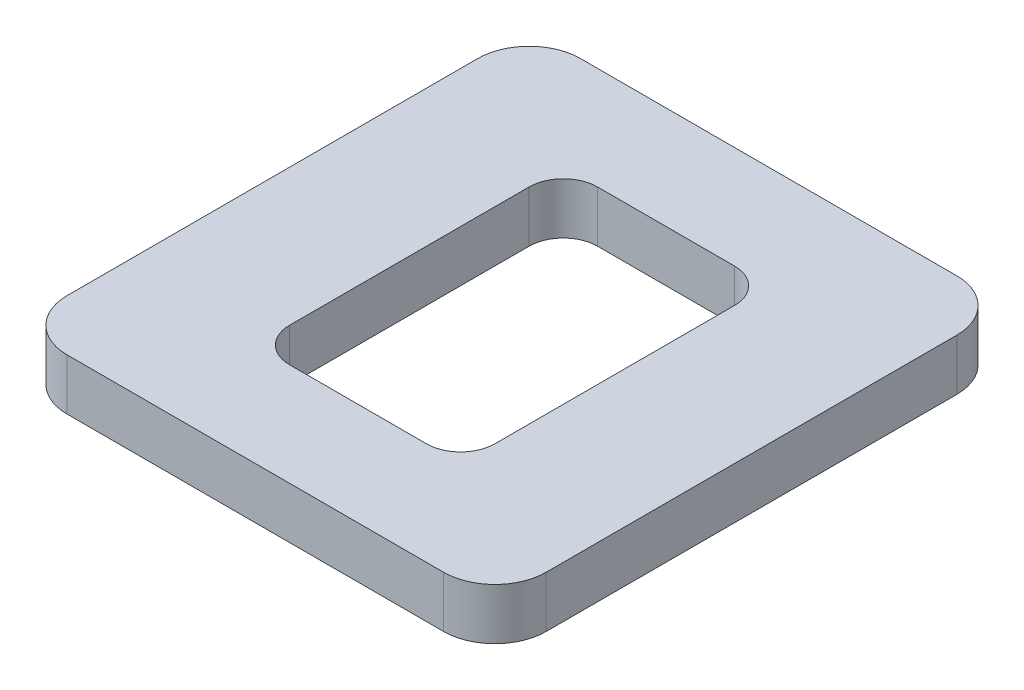
from build123d import *

# Parameters (mm, degrees)
EXTRUDE_START     = 87
EXTRUDE_236_DEPTH = 3


with BuildPart() as part:
    # 草图1 → Extrude 236 (new body)
    with BuildSketch(Plane(origin=(0, 0, 0), x_dir=(1, 0, 0), z_dir=(0, 1, 0)).offset(EXTRUDE_START)):
        with BuildLine():
            Line((-11, -43), (11, -43))
            ThreePointArc((11, -43), (13.121320344, -42.121320344), (14, -40))
            Line((14, -40), (14, -16))
            ThreePointArc((14, -16), (13.121320344, -13.878679656), (11, -13))
            Line((11, -13), (-11, -13))
            ThreePointArc((-11, -13), (-13.121320344, -13.878679656), (-14, -16))
            Line((-14, -16), (-14, -40))
            ThreePointArc((-14, -40), (-13.121320344, -42.121320344), (-11, -43))
        make_face()
        with BuildLine():
            Line((-4, -37), (4, -37))
            ThreePointArc((4, -37), (5.414213562, -36.414213562), (6, -35))
            Line((6, -35), (6, -21))
            ThreePointArc((6, -21), (5.414213562, -19.585786438), (4, -19))
            Line((4, -19), (-4, -19))
            ThreePointArc((-4, -19), (-5.414213562, -19.585786438), (-6, -21))
            Line((-6, -21), (-6, -35))
            ThreePointArc((-6, -35), (-5.414213562, -36.414213562), (-4, -37))
        make_face(mode=Mode.SUBTRACT)
    extrude(amount=EXTRUDE_236_DEPTH)


solid = part.part
